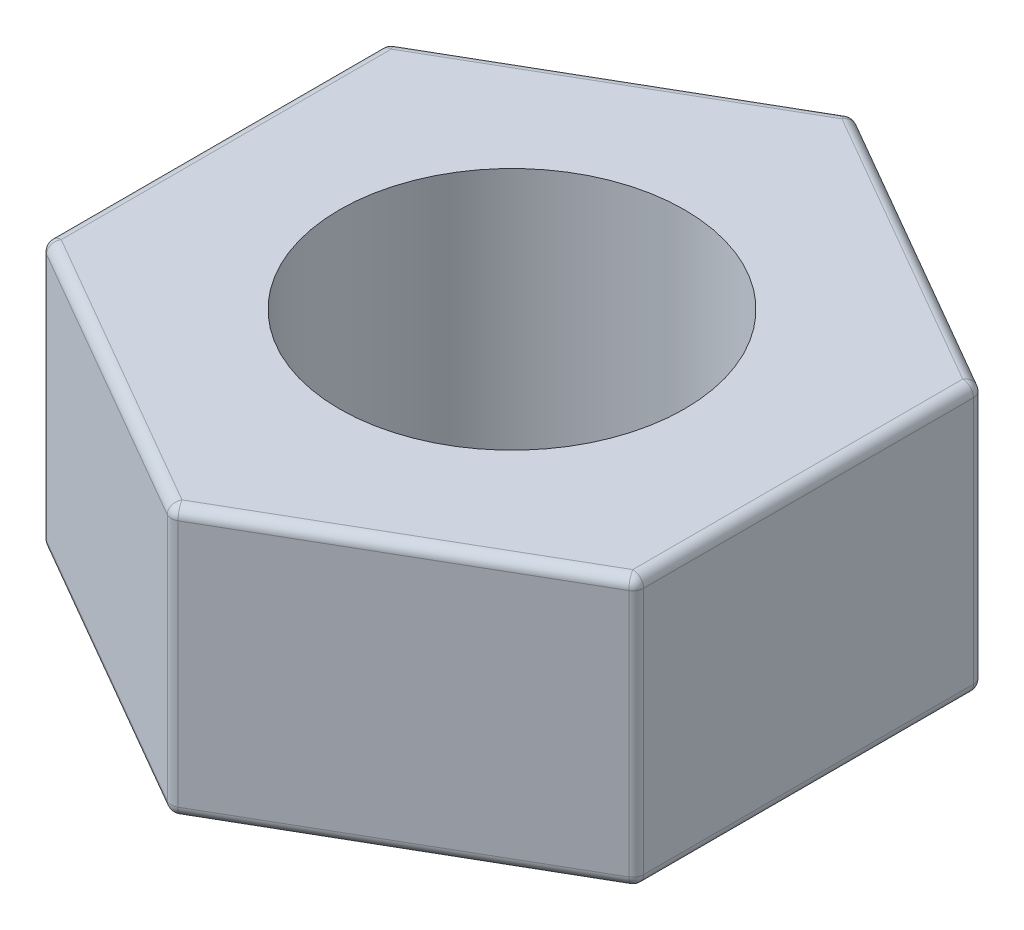
from build123d import *

# Parameters (mm, degrees)
SKETCH1_R           = 1.6
BOSS_EXTRUDE1_DEPTH = 2.5
FILLET1_R           = 0.1


with BuildPart() as part:
    # Sketch1 → Boss-Extrude1 (new body)
    with BuildSketch(Plane(origin=(0, 0, 0), x_dir=(1, 0, 0), z_dir=(0, 1, 0))):
        Polygon((0, 3.175426481), (-2.75, 1.58771324), (-2.75, -1.58771324), (0, -3.175426481), (2.75, -1.58771324), (2.75, 1.58771324), align=None)
        with Locations(Location((0, 0, 0), (0, 0, 270))):
            Circle(SKETCH1_R, mode=Mode.SUBTRACT)
    extrude(amount=BOSS_EXTRUDE1_DEPTH)

    # Fillet1
    fillet1_edges = [part.edges().sort_by_distance(p)[0] for p in [
        (2.75, 1.25, -1.58771324),
        (2.75, 1.25, 1.58771324),
        (0, 1.25, 3.175426481),
        (-2.75, 1.25, 1.58771324),
        (-2.75, 1.25, -1.58771324),
        (0, 1.25, -3.175426481),
        (-2.75, 2.5, 0),
        (-1.375, 2.5, 2.38156986),
        (1.375, 2.5, 2.38156986),
        (2.75, 2.5, 0),
        (1.375, 2.5, -2.38156986),
        (2.75, 0, 0),
        (1.375, 0, 2.38156986),
        (-1.375, 0, 2.38156986),
        (-2.75, 0, 0),
        (-1.375, 0, -2.38156986),
        (1.375, 0, -2.38156986),
        (-1.375, 2.5, -2.38156986),
    ]]
    fillet(fillet1_edges, radius=FILLET1_R)


solid = part.part
